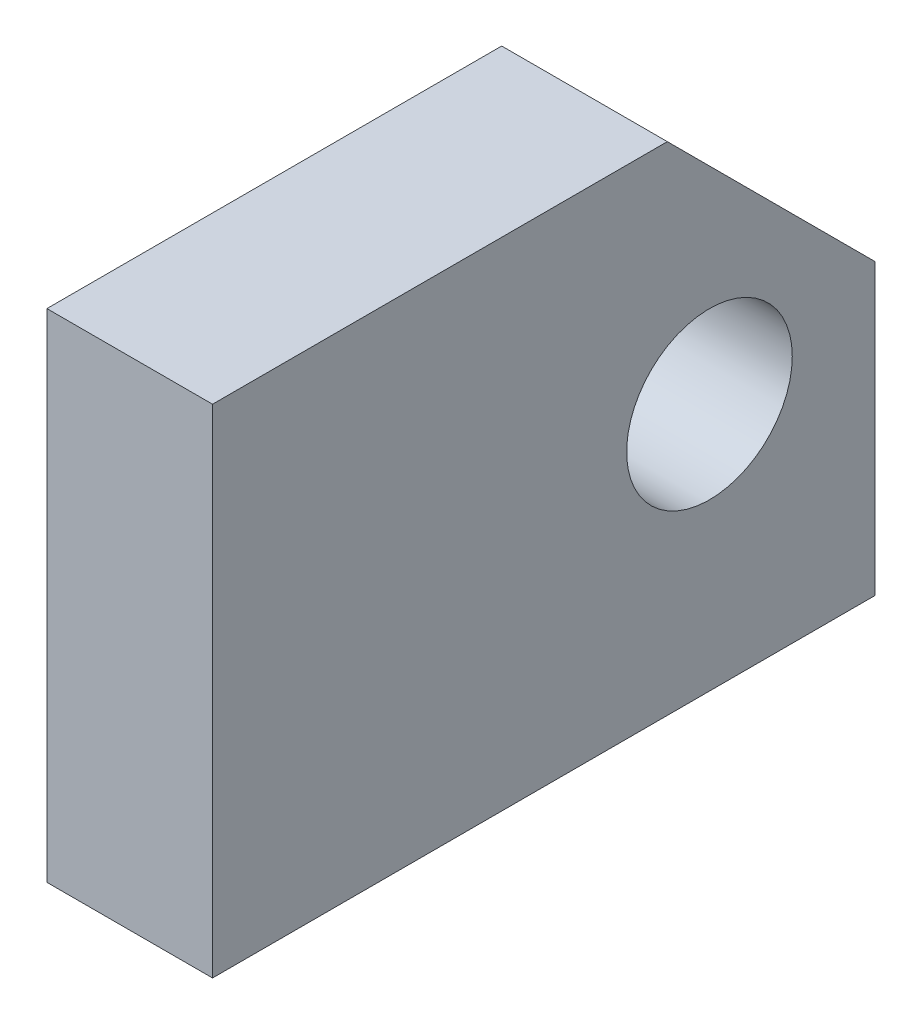
from build123d import *

# Parameters (mm, degrees)
SZKIC1_R                    = 5
DODANIE_WYCI_GNI_CIE1_DEPTH = 10


with BuildPart() as part:
    # Szkic1 → Dodanie-wyciągnięcie1 (new body)
    with BuildSketch(Plane(origin=(0, 0, 0), x_dir=(0, 0, -1), z_dir=(1, 0, 0))):
        Polygon((7.45669071, 15), (20, 2.45669071), (20, -15), (-20, -15), (-20, 15), align=None)
        with Locations((10, 0)):
            Circle(SZKIC1_R, mode=Mode.SUBTRACT)
    extrude(amount=DODANIE_WYCI_GNI_CIE1_DEPTH)


solid = part.part
